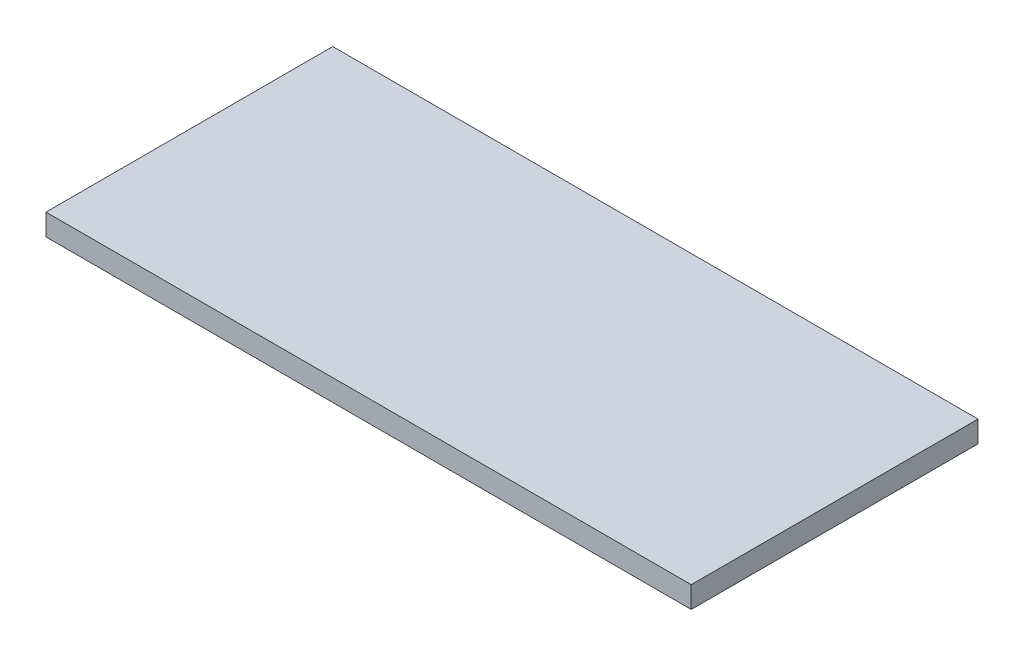
from build123d import *

# Parameters (mm, degrees)
ESBO_O1_W                = 450
ESBO_O1_H                = 200
RESSALTO_EXTRUS_O1_DEPTH = 15


with BuildPart() as part:
    # Esboço1 → Ressalto-extrusão1 (new body)
    with BuildSketch(Plane(origin=(0, 0, 0), x_dir=(1, 0, 0), z_dir=(0, 1, 0))):
        Rectangle(ESBO_O1_W, ESBO_O1_H)
    extrude(amount=RESSALTO_EXTRUS_O1_DEPTH)


solid = part.part
